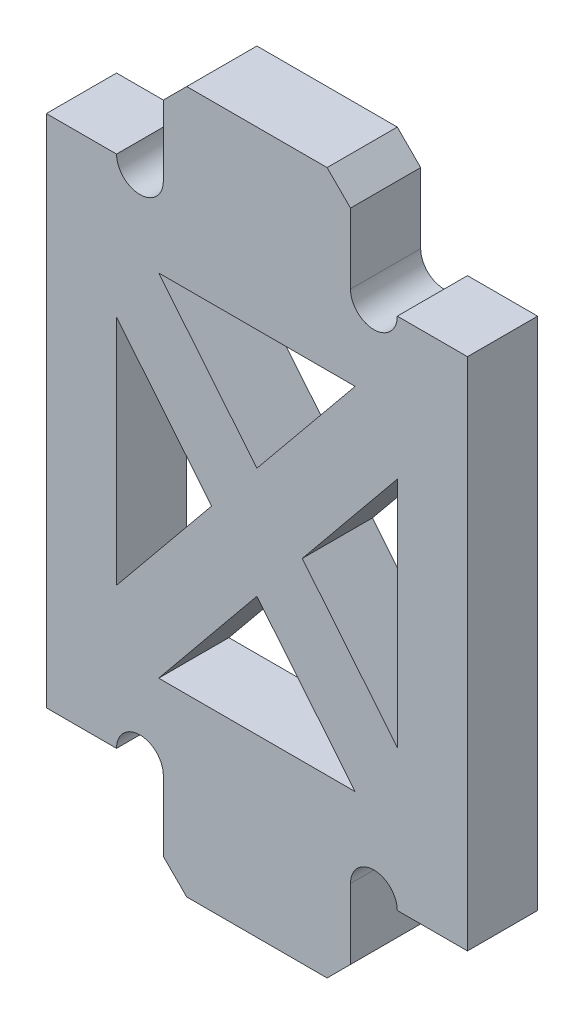
from build123d import *

# Parameters (mm, degrees)
EXTRUDE_1_DEPTH = 1.5
CHAMFER_1_SIZE  = 1


with BuildPart() as part:
    # 草图1 → 凸台-拉伸1 (new, symmetric)
    with BuildSketch(Plane.XY):
        with BuildLine():
            Line((-4, 15), (-4, 11))
            ThreePointArc((-4, 11), (-5, 10), (-6, 11))
            Line((-6, 11), (-9, 11))
            Line((-9, 11), (-9, -11))
            Line((-9, -11), (-6, -11))
            ThreePointArc((-6, -11), (-5, -10), (-4, -11))
            Line((-4, -11), (-4, -15))
            Line((-4, -15), (4, -15))
            Line((4, -15), (4, -11))
            ThreePointArc((4, -11), (5, -10), (6, -11))
            Line((6, -11), (9, -11))
            Line((9, -11), (9, 11))
            Line((9, 11), (6, 11))
            ThreePointArc((6, 11), (5, 10), (4, 11))
            Line((4, 11), (4, 15))
            Line((4, 15), (-4, 15))
        make_face()
        Polygon((1.938091419, 0), (6, 4.964554933), (6, -4.964554933), align=None, mode=Mode.SUBTRACT)
        Polygon((0, -2.368778401), (4.198272218, -7.5), (-4.198272218, -7.5), align=None, mode=Mode.SUBTRACT)
        Polygon((-6, 4.964554933), (-1.938091419, 0), (-6, -4.964554933), align=None, mode=Mode.SUBTRACT)
        Polygon((-4.198272218, 7.5), (4.198272218, 7.5), (0, 2.368778401), align=None, mode=Mode.SUBTRACT)
    extrude(amount=EXTRUDE_1_DEPTH, both=True)

    # 倒角1
    chamfer_1_edges = [part.edges().sort_by_distance(p)[0] for p in [
        (-4, 15, 0),
        (4, 15, 0),
        (4, -15, 0),
        (-4, -15, 0),
    ]]
    chamfer(chamfer_1_edges, length=CHAMFER_1_SIZE)


solid = part.part
